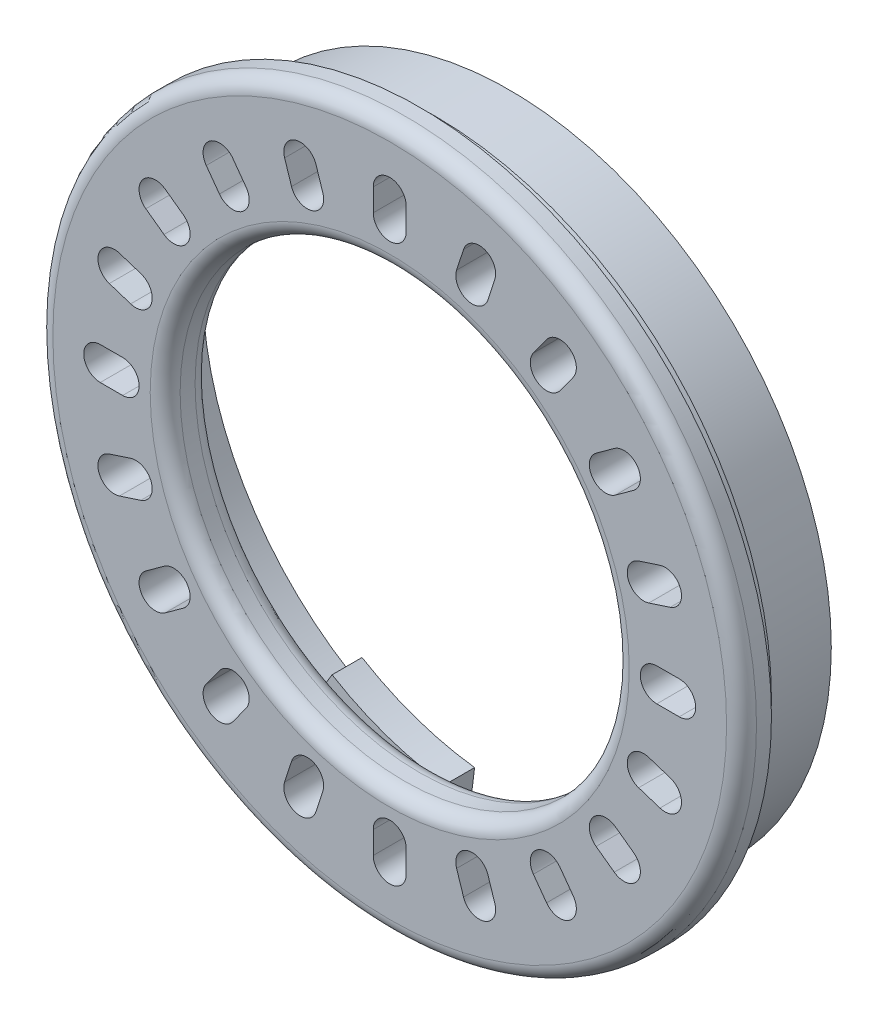
from build123d import *

# Parameters (mm, degrees)
SKETCH_1_R          = 23.515666667
SKETCH_1_R_2        = 15.01
EXTRUDE_1_DEPTH     = 3
SKETCH_2_R          = 23.515666667
SKETCH_2_R_2        = 22.515666667
CUT_EXTRUDE_3_DEPTH = 1
FILLET_1_R          = 1
FILLET_2_R          = 1
FILLET_3_R          = 1
CUT_EXTRUDE_4_DEPTH = 34.391213778
SKETCH_5_R          = 21.515666667
SKETCH_5_R_2        = 20.515666667
EXTRUDE_2_DEPTH     = 5
EXTRUDE_3_DEPTH     = 2


with BuildPart() as part:
    # 草图1 → 凸台-拉伸1 (new body)
    with BuildSketch(Plane.XY):
        Circle(SKETCH_1_R)
        Circle(SKETCH_1_R_2, mode=Mode.SUBTRACT)
    extrude(amount=EXTRUDE_1_DEPTH)

    # 草图2 → 切除-拉伸3 (cut)
    with BuildSketch(Plane(origin=(0, 0, 0), x_dir=(-1, 0, 0), z_dir=(0, 0, -1))):
        Circle(SKETCH_2_R)
        Circle(SKETCH_2_R_2, mode=Mode.SUBTRACT)
    extrude(amount=-CUT_EXTRUDE_3_DEPTH, mode=Mode.SUBTRACT)

    # 圆角1
    fillet_1_edges = [part.edges().sort_by_distance(p)[0] for p in [
        (-23.515666667, 0, 3),
    ]]
    fillet(fillet_1_edges, radius=FILLET_1_R)

    # 圆角2
    fillet_2_edges = [part.edges().sort_by_distance(p)[0] for p in [
        (-15.01, 0, 3),
    ]]
    fillet(fillet_2_edges, radius=FILLET_2_R)

    # 圆角3
    fillet_3_edges = [part.edges().sort_by_distance(p)[0] for p in [
        (-15.01, 0, 0),
    ]]
    fillet(fillet_3_edges, radius=FILLET_3_R)

    # 草图3 → 切除-拉伸4 (cut, through all)
    with BuildSketch(Plane.XY.offset(3)):
        with BuildLine():
            Line((1.1, 19.35), (1.1, 17.85))
            ThreePointArc((1.1, 17.85), (0, 16.75), (-1.1, 17.85))
            Line((-1.1, 17.85), (-1.1, 19.35))
            ThreePointArc((-1.1, 19.35), (0, 20.45), (1.1, 19.35))
        make_face()
        with BuildLine():
            Line((7.025641009, 18.063024896), (6.562115518, 16.636440122))
            ThreePointArc((6.562115518, 16.636440122), (5.176034656, 15.930196648), (4.469791182, 17.31627751))
            Line((4.469791182, 17.31627751), (4.933316673, 18.742862284))
            ThreePointArc((4.933316673, 18.742862284), (6.319397535, 19.449105758), (7.025641009, 18.063024896))
        make_face()
        with BuildLine():
            Line((12.263563326, 15.007915064), (11.381885447, 13.794389572))
            ThreePointArc((11.381885447, 13.794389572), (9.845402976, 13.551034656), (9.60204806, 15.087517127))
            Line((9.60204806, 15.087517127), (10.483725938, 16.301042619))
            ThreePointArc((10.483725938, 16.301042619), (12.020208409, 16.544397535), (12.263563326, 15.007915064))
        make_face()
        with BuildLine():
            Line((16.301042619, 10.483725938), (15.087517127, 9.60204806))
            ThreePointArc((15.087517127, 9.60204806), (13.551034656, 9.845402976), (13.794389572, 11.381885447))
            Line((13.794389572, 11.381885447), (15.007915064, 12.263563326))
            ThreePointArc((15.007915064, 12.263563326), (16.544397535, 12.020208409), (16.301042619, 10.483725938))
        make_face()
        with BuildLine():
            Line((18.742862284, 4.933316673), (17.31627751, 4.469791182))
            ThreePointArc((17.31627751, 4.469791182), (15.930196648, 5.176034656), (16.636440122, 6.562115518))
            Line((16.636440122, 6.562115518), (18.063024896, 7.025641009))
            ThreePointArc((18.063024896, 7.025641009), (19.449105758, 6.319397535), (18.742862284, 4.933316673))
        make_face()
        with BuildLine():
            Line((19.35, -1.1), (17.85, -1.1))
            ThreePointArc((17.85, -1.1), (16.75, 0), (17.85, 1.1))
            Line((17.85, 1.1), (19.35, 1.1))
            ThreePointArc((19.35, 1.1), (20.45, 0), (19.35, -1.1))
        make_face()
        with BuildLine():
            Line((18.063024896, -7.025641009), (16.636440122, -6.562115518))
            ThreePointArc((16.636440122, -6.562115518), (15.930196648, -5.176034656), (17.31627751, -4.469791182))
            Line((17.31627751, -4.469791182), (18.742862284, -4.933316673))
            ThreePointArc((18.742862284, -4.933316673), (19.449105758, -6.319397535), (18.063024896, -7.025641009))
        make_face()
        with BuildLine():
            Line((15.007915064, -12.263563326), (13.794389572, -11.381885447))
            ThreePointArc((13.794389572, -11.381885447), (13.551034656, -9.845402976), (15.087517127, -9.60204806))
            Line((15.087517127, -9.60204806), (16.301042619, -10.483725938))
            ThreePointArc((16.301042619, -10.483725938), (16.544397535, -12.020208409), (15.007915064, -12.263563326))
        make_face()
        with BuildLine():
            Line((10.483725938, -16.301042619), (9.60204806, -15.087517127))
            ThreePointArc((9.60204806, -15.087517127), (9.845402976, -13.551034656), (11.381885447, -13.794389572))
            Line((11.381885447, -13.794389572), (12.263563326, -15.007915064))
            ThreePointArc((12.263563326, -15.007915064), (12.020208409, -16.544397535), (10.483725938, -16.301042619))
        make_face()
        with BuildLine():
            Line((4.933316673, -18.742862284), (4.469791182, -17.31627751))
            ThreePointArc((4.469791182, -17.31627751), (5.176034656, -15.930196648), (6.562115518, -16.636440122))
            Line((6.562115518, -16.636440122), (7.025641009, -18.063024896))
            ThreePointArc((7.025641009, -18.063024896), (6.319397535, -19.449105758), (4.933316673, -18.742862284))
        make_face()
        with BuildLine():
            Line((-1.1, -19.35), (-1.1, -17.85))
            ThreePointArc((-1.1, -17.85), (0, -16.75), (1.1, -17.85))
            Line((1.1, -17.85), (1.1, -19.35))
            ThreePointArc((1.1, -19.35), (0, -20.45), (-1.1, -19.35))
        make_face()
        with BuildLine():
            Line((-7.025641009, -18.063024896), (-6.562115518, -16.636440122))
            ThreePointArc((-6.562115518, -16.636440122), (-5.176034656, -15.930196648), (-4.469791182, -17.31627751))
            Line((-4.469791182, -17.31627751), (-4.933316673, -18.742862284))
            ThreePointArc((-4.933316673, -18.742862284), (-6.319397535, -19.449105758), (-7.025641009, -18.063024896))
        make_face()
        with BuildLine():
            Line((-12.263563326, -15.007915064), (-11.381885447, -13.794389572))
            ThreePointArc((-11.381885447, -13.794389572), (-9.845402976, -13.551034656), (-9.60204806, -15.087517127))
            Line((-9.60204806, -15.087517127), (-10.483725938, -16.301042619))
            ThreePointArc((-10.483725938, -16.301042619), (-12.020208409, -16.544397535), (-12.263563326, -15.007915064))
        make_face()
        with BuildLine():
            Line((-16.301042619, -10.483725938), (-15.087517127, -9.60204806))
            ThreePointArc((-15.087517127, -9.60204806), (-13.551034656, -9.845402976), (-13.794389572, -11.381885447))
            Line((-13.794389572, -11.381885447), (-15.007915064, -12.263563326))
            ThreePointArc((-15.007915064, -12.263563326), (-16.544397535, -12.020208409), (-16.301042619, -10.483725938))
        make_face()
        with BuildLine():
            Line((-18.742862284, -4.933316673), (-17.31627751, -4.469791182))
            ThreePointArc((-17.31627751, -4.469791182), (-15.930196648, -5.176034656), (-16.636440122, -6.562115518))
            Line((-16.636440122, -6.562115518), (-18.063024896, -7.025641009))
            ThreePointArc((-18.063024896, -7.025641009), (-19.449105758, -6.319397535), (-18.742862284, -4.933316673))
        make_face()
        with BuildLine():
            Line((-19.35, 1.1), (-17.85, 1.1))
            ThreePointArc((-17.85, 1.1), (-16.75, 0), (-17.85, -1.1))
            Line((-17.85, -1.1), (-19.35, -1.1))
            ThreePointArc((-19.35, -1.1), (-20.45, 0), (-19.35, 1.1))
        make_face()
        with BuildLine():
            Line((-18.063024896, 7.025641009), (-16.636440122, 6.562115518))
            ThreePointArc((-16.636440122, 6.562115518), (-15.930196648, 5.176034656), (-17.31627751, 4.469791182))
            Line((-17.31627751, 4.469791182), (-18.742862284, 4.933316673))
            ThreePointArc((-18.742862284, 4.933316673), (-19.449105758, 6.319397535), (-18.063024896, 7.025641009))
        make_face()
        with BuildLine():
            Line((-15.007915064, 12.263563326), (-13.794389572, 11.381885447))
            ThreePointArc((-13.794389572, 11.381885447), (-13.551034656, 9.845402976), (-15.087517127, 9.60204806))
            Line((-15.087517127, 9.60204806), (-16.301042619, 10.483725938))
            ThreePointArc((-16.301042619, 10.483725938), (-16.544397535, 12.020208409), (-15.007915064, 12.263563326))
        make_face()
        with BuildLine():
            Line((-10.483725938, 16.301042619), (-9.60204806, 15.087517127))
            ThreePointArc((-9.60204806, 15.087517127), (-9.845402976, 13.551034656), (-11.381885447, 13.794389572))
            Line((-11.381885447, 13.794389572), (-12.263563326, 15.007915064))
            ThreePointArc((-12.263563326, 15.007915064), (-12.020208409, 16.544397535), (-10.483725938, 16.301042619))
        make_face()
        with BuildLine():
            Line((-4.933316673, 18.742862284), (-4.469791182, 17.31627751))
            ThreePointArc((-4.469791182, 17.31627751), (-5.176034656, 15.930196648), (-6.562115518, 16.636440122))
            Line((-6.562115518, 16.636440122), (-7.025641009, 18.063024896))
            ThreePointArc((-7.025641009, 18.063024896), (-6.319397535, 19.449105758), (-4.933316673, 18.742862284))
        make_face()
    extrude(amount=-CUT_EXTRUDE_4_DEPTH, mode=Mode.SUBTRACT)

    # 草图5 → 凸台-拉伸2 (add)
    with BuildSketch(Plane(origin=(0, 0, 0), x_dir=(-1, 0, 0), z_dir=(0, 0, -1))):
        with Locations(Location((0, 0, 0), (0, 0, 180))):
            Circle(SKETCH_5_R)
        Circle(SKETCH_5_R_2, mode=Mode.SUBTRACT)
    extrude(amount=EXTRUDE_2_DEPTH)

    # 草图6 → 凸台-拉伸3 (add)
    with BuildSketch(Plane(origin=(0, 0, -5), x_dir=(-1, 0, 0), z_dir=(0, 0, -1))):
        with BuildLine():
            Line((-16.26911987, -9.852722397), (-18.353991972, -11.115339319))
            ThreePointArc((-18.353991972, -11.115339319), (-20.274508623, -7.025958268), (-21.29621173, -2.625101039))
            Line((-21.29621173, -2.625101039), (-18.877126128, -2.326909783))
            ThreePointArc((-18.877126128, -2.326909783), (-17.971480624, -6.227863532), (-16.26911987, -9.852722397))
        make_face()
        with BuildLine():
            Line((-9.852722397, 16.26911987), (-11.115339319, 18.353991972))
            ThreePointArc((-11.115339319, 18.353991972), (-7.025958268, 20.274508623), (-2.625101039, 21.29621173))
            Line((-2.625101039, 21.29621173), (-2.326909783, 18.877126128))
            ThreePointArc((-2.326909783, 18.877126128), (-6.227863532, 17.971480624), (-9.852722397, 16.26911987))
        make_face()
        with BuildLine():
            Line((16.26911987, 9.852722397), (18.353991972, 11.115339319))
            ThreePointArc((18.353991972, 11.115339319), (20.274508623, 7.025958268), (21.29621173, 2.625101039))
            Line((21.29621173, 2.625101039), (18.877126128, 2.326909783))
            ThreePointArc((18.877126128, 2.326909783), (17.971480624, 6.227863532), (16.26911987, 9.852722397))
        make_face()
        with BuildLine():
            Line((9.852722397, -16.26911987), (11.115339319, -18.353991972))
            ThreePointArc((11.115339319, -18.353991972), (7.025958268, -20.274508623), (2.625101039, -21.29621173))
            Line((2.625101039, -21.29621173), (2.326909783, -18.877126128))
            ThreePointArc((2.326909783, -18.877126128), (6.227863532, -17.971480624), (9.852722397, -16.26911987))
        make_face()
    extrude(amount=-EXTRUDE_3_DEPTH)


solid = part.part
